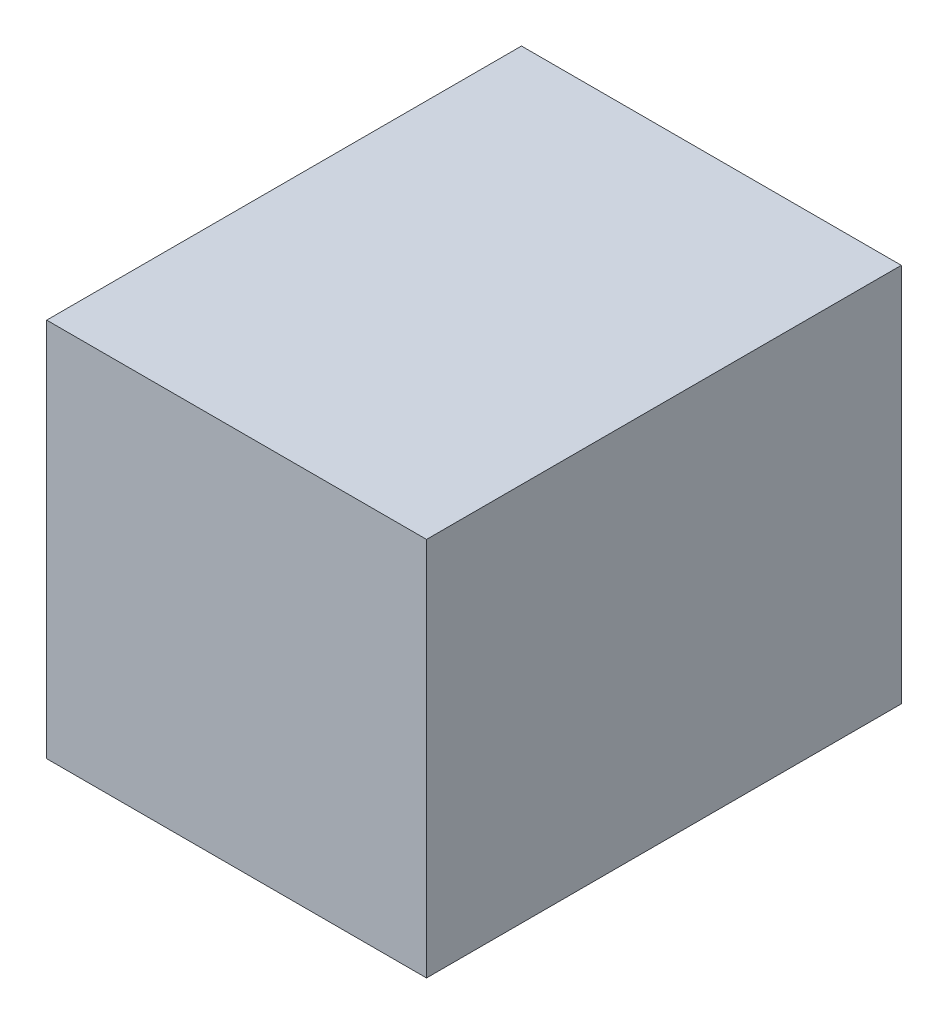
from build123d import *

# Parameters (mm, degrees)
SKETCH1_W           = 0.8
SKETCH1_H           = 1
BOSS_EXTRUDE1_DEPTH = 0.8


with BuildPart() as part:
    # Sketch1 → Boss-Extrude1 (new body)
    with BuildSketch(Plane(origin=(0, 0, 0), x_dir=(1, 0, 0), z_dir=(0, 1, 0))):
        with Locations((0.4, 0.5)):
            Rectangle(SKETCH1_W, SKETCH1_H)
    extrude(amount=BOSS_EXTRUDE1_DEPTH)


solid = part.part
